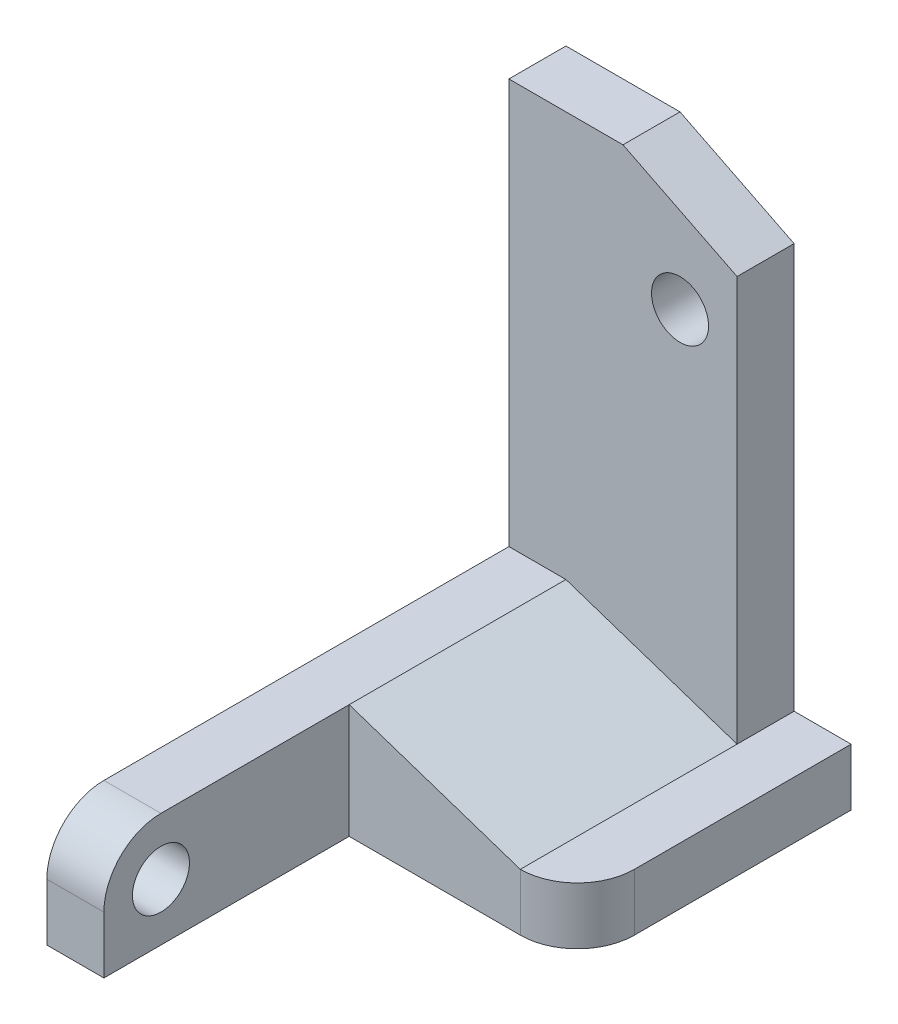
from build123d import *

# Parameters (mm, degrees)
SKETCH1_R           = 127
BOSS_EXTRUDE1_DEPTH = 254
BOSS_EXTRUDE2_DEPTH = 1219.2
FILLET1_R           = 254
SKETCH2_W           = 2311.4
SKETCH2_H           = 508
SKETCH2_R           = 127
BOSS_EXTRUDE3_DEPTH = 254
FILLET2_R           = 254


with BuildPart() as part:
    # Sketch1 → Boss-Extrude1 (new body)
    with BuildSketch(Plane.XY):
        Polygon((0, 2311.4), (0, 508), (254, 508), (1016, 254), (1016, 2057.4), (508, 2311.4), align=None)
        with Locations((762, 1803.4)):
            Circle(SKETCH1_R, mode=Mode.SUBTRACT)
    extrude(amount=BOSS_EXTRUDE1_DEPTH)

    # Sketch1<3> → Boss-Extrude2 (add)
    with BuildSketch(Plane.XY):
        Polygon((254, 508), (254, 0), (1270, 0), (1270, 254), (1016, 254), align=None)
    extrude(amount=BOSS_EXTRUDE2_DEPTH)

    # Fillet1
    fillet1_edges = [part.edges().sort_by_distance(p)[0] for p in [
        (1270, 127, 1219.2),
    ]]
    fillet(fillet1_edges, radius=FILLET1_R)

    # Sketch2 → Boss-Extrude3 (add)
    with BuildSketch(Plane.ZY.offset(-254)):
        with Locations((1155.7, 254)):
            Rectangle(SKETCH2_W, SKETCH2_H)
        with Locations((2057.4, 254)):
            Circle(SKETCH2_R, mode=Mode.SUBTRACT)
    extrude(amount=BOSS_EXTRUDE3_DEPTH)

    # Fillet2
    fillet2_edges = [part.edges().sort_by_distance(p)[0] for p in [
        (127, 508, 2311.4),
    ]]
    fillet(fillet2_edges, radius=FILLET2_R)


solid = part.part
